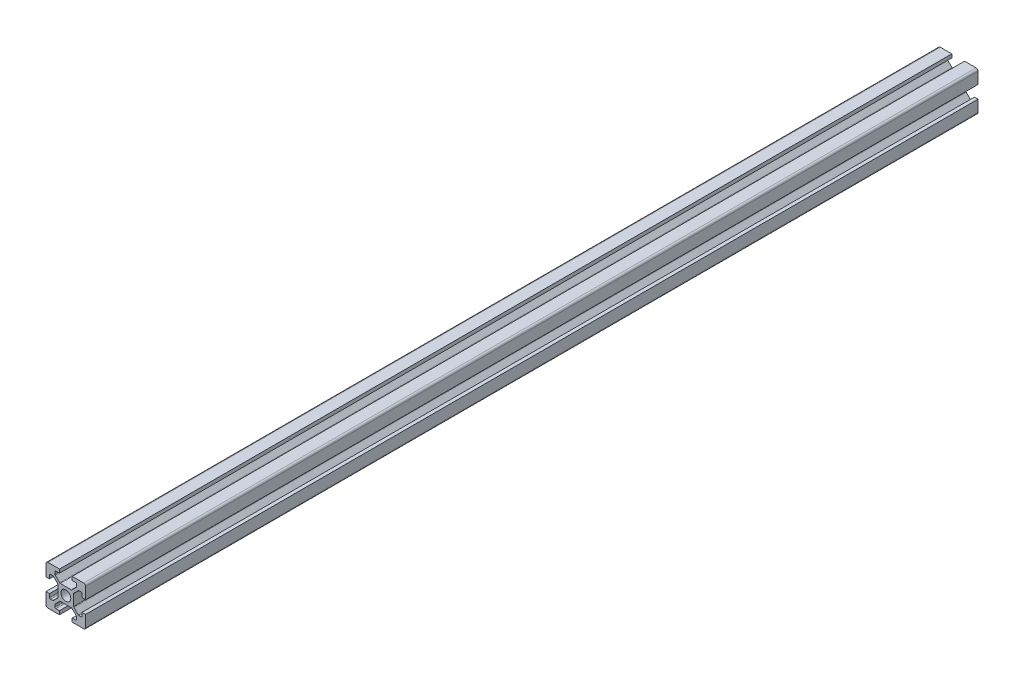
from build123d import *

# Parameters (mm, degrees)
SKETCH1_R           = 2.5
BOSS_EXTRUDE1_DEPTH = 450
FILLET1_R           = 1
FILLET2_R           = 0.5
FILLET3_R           = 0.5
FILLET4_R           = 0.5
FILLET5_R           = 0.5


with BuildPart() as part:
    # Sketch1 → Boss-Extrude1 (new body)
    with BuildSketch(Plane.XY):
        Polygon((13.2, 0), (13.2, 1.8), (15.45, 1.8), (15.45, 3.6), (12.95, 6.1), (7.05, 6.1), (4.55, 3.6), (4.55, 1.8), (6.8, 1.8), (6.8, 0), (0, 0), (0, 6.8), (1.8, 6.8), (1.8, 4.55), (3.6, 4.55), (6.1, 7.05), (6.1, 12.95), (3.6, 15.45), (1.8, 15.45), (1.8, 13.2), (0, 13.2), (0, 20), (6.8, 20), (6.8, 18.2), (4.55, 18.2), (4.55, 16.4), (7.05, 13.9), (12.95, 13.9), (15.45, 16.4), (15.45, 18.2), (13.2, 18.2), (13.2, 20), (20, 20), (20, 13.2), (18.2, 13.2), (18.2, 15.45), (16.4, 15.45), (13.9, 12.95), (13.9, 7.05), (16.4, 4.55), (18.2, 4.55), (18.2, 6.8), (20, 6.8), (20, 0), align=None)
        with Locations(Location((10, 10, 0), (0, 0, 270))):
            Circle(SKETCH1_R, mode=Mode.SUBTRACT)
    extrude(amount=BOSS_EXTRUDE1_DEPTH)

    # Fillet1
    fillet1_edges = [part.edges().sort_by_distance(p)[0] for p in [
        (0, 0, 225),
        (20, 0, 225),
        (20, 20, 225),
        (0, 20, 225),
    ]]
    fillet(fillet1_edges, radius=FILLET1_R)

    # Fillet2
    fillet2_edges = [part.edges().sort_by_distance(p)[0] for p in [
        (15.45, 18.2, 225),
        (15.45, 16.4, 225),
        (12.95, 13.9, 225),
        (7.05, 13.9, 225),
        (4.55, 16.4, 225),
        (4.55, 18.2, 225),
    ]]
    fillet(fillet2_edges, radius=FILLET2_R)

    # Fillet3
    fillet3_edges = [part.edges().sort_by_distance(p)[0] for p in [
        (18.2, 4.55, 225),
        (16.4, 4.55, 225),
        (13.9, 7.05, 225),
        (13.9, 12.95, 225),
        (16.4, 15.45, 225),
        (18.2, 15.45, 225),
    ]]
    fillet(fillet3_edges, radius=FILLET3_R)

    # Fillet4
    fillet4_edges = [part.edges().sort_by_distance(p)[0] for p in [
        (1.8, 15.45, 225),
        (3.6, 15.45, 225),
        (6.1, 12.95, 225),
        (6.1, 7.05, 225),
        (3.6, 4.55, 225),
        (1.8, 4.55, 225),
    ]]
    fillet(fillet4_edges, radius=FILLET4_R)

    # Fillet5
    fillet5_edges = [part.edges().sort_by_distance(p)[0] for p in [
        (4.55, 1.8, 225),
        (4.55, 3.6, 225),
        (7.05, 6.1, 225),
        (12.95, 6.1, 225),
        (15.45, 3.6, 225),
        (15.45, 1.8, 225),
    ]]
    fillet(fillet5_edges, radius=FILLET5_R)


solid = part.part
